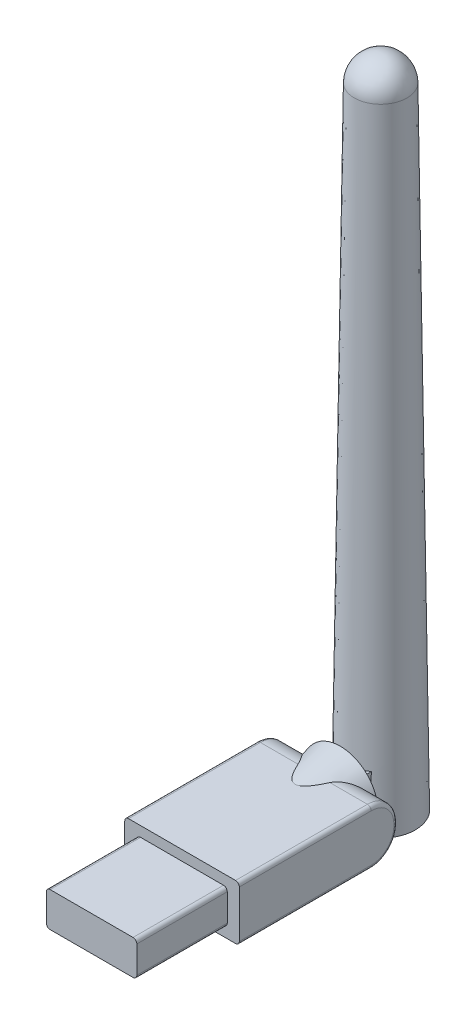
from build123d import *

# Parameters (mm, degrees)
SKETCH1_W           = 12
SKETCH1_H           = 4.6
BOSS_EXTRUDE1_DEPTH = 12
SKETCH2_W           = 15.2
SKETCH2_H           = 7.25
BOSS_EXTRUDE2_DEPTH = 21
FILLET1_R           = 3.5
BOSS_EXTRUDE3_START = -0.952452
SKETCH4_W           = 5
SKETCH4_H           = 5
BOSS_EXTRUDE3_DEPTH = 7.452452
FILLET2_R           = 0.5
FILLET3_R           = 0.5


with BuildPart() as part:
    # Sketch1 → Boss-Extrude1 (new body)
    with BuildSketch(Plane.XY):
        with Locations((6, 2.3)):
            Rectangle(SKETCH1_W, SKETCH1_H)
    extrude(amount=BOSS_EXTRUDE1_DEPTH)

    # Sketch2 → Boss-Extrude2 (add)
    with BuildSketch(Plane(origin=(0, 0, 0), x_dir=(-1, 0, 0), z_dir=(0, 0, -1))):
        with Locations((-6, 2.325)):
            Rectangle(SKETCH2_W, SKETCH2_H)
    extrude(amount=BOSS_EXTRUDE2_DEPTH)

    # Fillet1
    fillet1_edges = [part.edges().sort_by_distance(p)[0] for p in [
        (6, -1.3, -21),
        (6, 5.95, -21),
    ]]
    fillet(fillet1_edges, radius=FILLET1_R)

    # Sketch4 → Boss-Extrude3 (add)
    with BuildSketch(Plane(origin=(0, 0, -21), x_dir=(-1, 0, 0), z_dir=(0, 0, -1)).offset(BOSS_EXTRUDE3_START)):
        with Locations((-6, 2.35)):
            Rectangle(SKETCH4_W, SKETCH4_H)
    extrude(amount=BOSS_EXTRUDE3_DEPTH)

    # Sketch5 → Revolve1 (revolve)
    with BuildSketch(Plane(origin=(6, 0, 0), x_dir=(0, 0, -1), z_dir=(1, 0, 0)), mode=Mode.PRIVATE) as revolve1_sk:
        with BuildLine():
            Line((26.35, -2.675), (26.35, 84.325))
            ThreePointArc((26.35, 84.325), (23.891258371, 83.316024239), (22.85, 80.870779161))
            Line((22.85, 80.870779161), (21.75, -2.675))
            Line((21.75, -2.675), (26.35, -2.675))
        make_face()
    revolve(revolve1_sk.sketch.rotate(Axis((6, -2.675, -26.35), (0, 1, 0)), 90), axis=Axis((6, -2.675, -26.35), (0, 1, 0)))

    # Sketch6 → Revolve2 (revolve)
    with BuildSketch(Plane(origin=(6, 0, 0), x_dir=(0, 0, -1), z_dir=(1, 0, 0))):
        Polygon((21, 2.325), (21, 7.325), (15, 5.95), (15, 2.325), align=None)
    revolve(axis=Axis((6, 2.325, -15), (0, 0, -1)))

    # Fillet2
    fillet2_edges = [part.edges().sort_by_distance(p)[0] for p in [
        (13.6, 2.325, -21),
        (-1.6, 2.325, -21),
        (-1.6, 5.95, -8.75),
        (-1.6, -1.3, -8.75),
        (-1.6, 4.924873734, -19.974873734),
        (-1.6, -0.274873734, -19.974873734),
        (13.6, -1.3, -8.75),
        (13.6, 5.95, -8.75),
        (13.6, 4.924873734, -19.974873734),
        (13.6, -0.274873734, -19.974873734),
    ]]
    fillet(fillet2_edges, radius=FILLET2_R)

    # Fillet3
    fillet3_edges = [part.edges().sort_by_distance(p)[0] for p in [
        (0, 4.6, 6),
        (12, 4.6, 6),
        (12, 0, 6),
        (0, 0, 6),
    ]]
    fillet(fillet3_edges, radius=FILLET3_R)


solid = part.part
